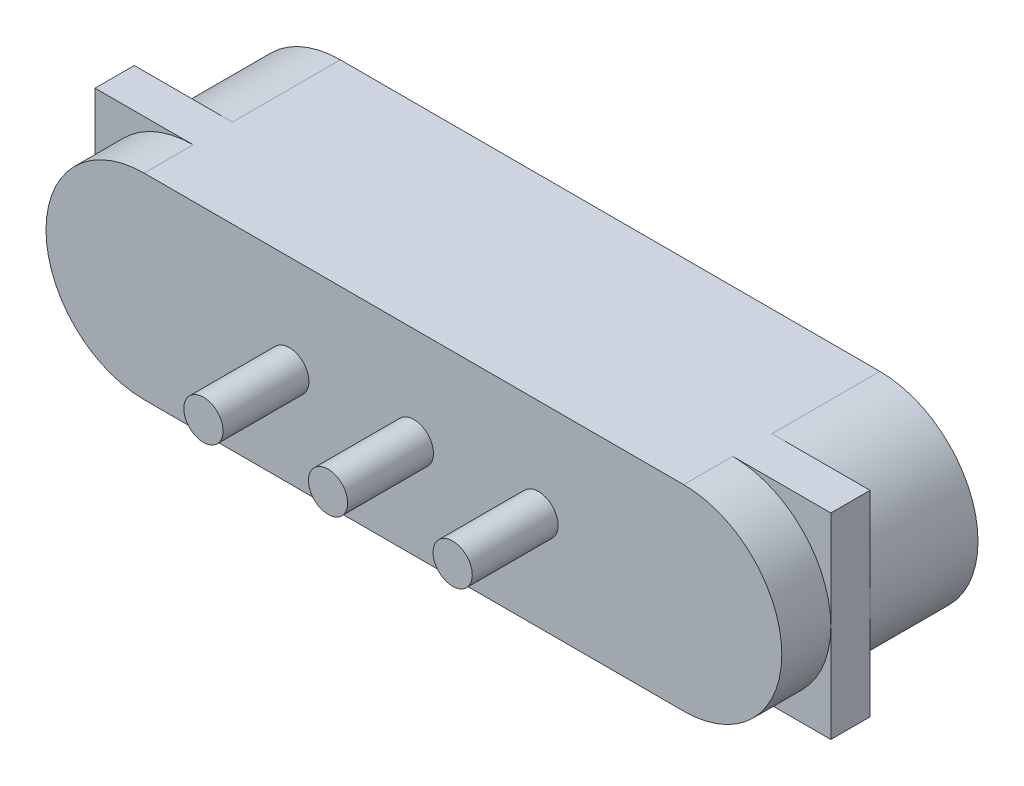
from build123d import *

# Parameters (mm, degrees)
EXTRUDE_1_DEPTH     = 4
EXTRUDE_START       = -2.2
SKETCH_2_W          = 15
SKETCH_2_H          = 4
EXTRUDE_2_DEPTH     = 0.8
SKETCH_3_R          = 0.5
EXTRUDE_3_DEPTH     = 1
FILLET_1_R          = 0.5
SKETCH_4_R          = 0.4
EXTRUDE_4_DEPTH     = 1.75
CUT_EXTRUDE_START   = 1.75
CUT_EXTRUDE_1_DEPTH = 1.75
SKETCH_8_R          = 0.5
CUT_EXTRUDE_2_DEPTH = 0.1


with BuildPart() as part:
    # 草图1 → 凸台-拉伸1 (new body)
    with BuildSketch(Plane.XY):
        with BuildLine():
            Line((0, 2), (11, 2))
            ThreePointArc((11, 2), (13, 0), (11, -2))
            Line((11, -2), (0, -2))
            ThreePointArc((0, -2), (-2, 0), (0, 2))
        make_face()
    extrude(amount=EXTRUDE_1_DEPTH)

    # 草图2 → 凸台-拉伸2 (add)
    with BuildSketch(Plane(origin=(0, 0, 0), x_dir=(-1, 0, 0), z_dir=(0, 0, -1)).offset(EXTRUDE_START)):
        with Locations((-5.5, 0)):
            Rectangle(SKETCH_2_W, SKETCH_2_H)
    extrude(amount=-EXTRUDE_2_DEPTH)

    # 草图3 → 凸台-拉伸3 (add)
    with BuildSketch(Plane(origin=(0, 0, 0), x_dir=(-1, 0, 0), z_dir=(0, 0, -1))):
        with Locations(Location((-8.04, 0, 0), (0, 0, 180))):
            Circle(SKETCH_3_R)
        with Locations(Location((-5.5, 0, 0), (0, 0, 180))):
            Circle(SKETCH_3_R)
        with Locations(Location((-2.96, 0, 0), (0, 0, 180))):
            Circle(SKETCH_3_R)
    extrude(amount=EXTRUDE_3_DEPTH)

    # 圆角1
    fillet_1_edges = [part.edges().sort_by_distance(p)[0] for p in [
        (7.54, 0, -1),
        (5, 0, -1),
        (2.46, 0, -1),
    ]]
    fillet(fillet_1_edges, radius=FILLET_1_R)

    # 草图4 → 凸台-拉伸4 (add)
    with BuildSketch(Plane.XY.offset(4)):
        with Locations((2.96, 0)):
            Circle(SKETCH_4_R)
        with Locations((5.5, 0)):
            Circle(SKETCH_4_R)
        with Locations((8.04, 0)):
            Circle(SKETCH_4_R)
    extrude(amount=EXTRUDE_4_DEPTH)

    # 草图7 → 切除-拉伸1 (cut)
    with BuildSketch(Plane(origin=(0, 0, 0), x_dir=(-1, 0, 0), z_dir=(0, 0, -1)).offset(CUT_EXTRUDE_START)):
        with BuildLine():
            Line((0, 2), (-11, 2))
            ThreePointArc((-11, 2), (-13, 0), (-11, -2))
            Line((-11, -2), (0, -2))
            ThreePointArc((0, -2), (2, 0), (0, 2))
        make_face()
    extrude(amount=-CUT_EXTRUDE_1_DEPTH, mode=Mode.SUBTRACT)

    # 草图8 → 切除-拉伸2 (cut)
    with BuildSketch(Plane(origin=(0, 0, 0), x_dir=(-1, 0, 0), z_dir=(0, 0, -1))):
        with Locations((-8.04, 0)):
            Circle(SKETCH_8_R)
        with Locations((-5.5, 0)):
            Circle(SKETCH_8_R)
        with Locations((-2.96, 0)):
            Circle(SKETCH_8_R)
    extrude(amount=-CUT_EXTRUDE_2_DEPTH, mode=Mode.SUBTRACT)


solid = part.part
